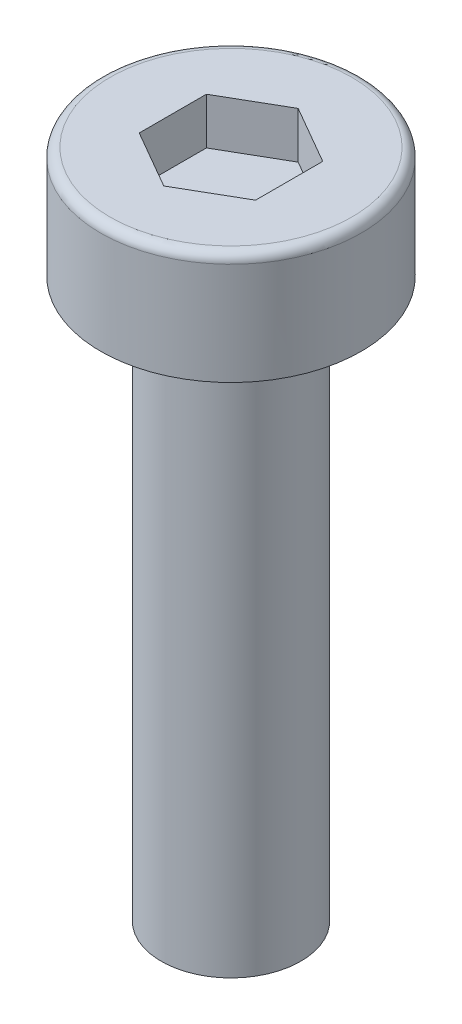
from build123d import *

# Parameters (mm, degrees)
CUT_EXTRUDE1_DEPTH = 1
FILLET1_R          = 0.2


with BuildPart() as part:
    # Sketch1 → Revolve1 (revolve)
    with BuildSketch(Plane.XY, mode=Mode.PRIVATE) as revolve1_sk:
        Polygon((0, 0), (0, 14.4), (2.8, 14.4), (2.8, 12), (1.5, 12), (1.5, 0), align=None)
    revolve(revolve1_sk.sketch.rotate(Axis((0, 0, 0), (0, 1, 0)), 90), axis=Axis((0, 0, 0), (0, 1, 0)))

    # Sketch2 → Cut-Extrude1 (cut)
    with BuildSketch(Plane(origin=(0, 14.4, 0), x_dir=(1, 0, 0), z_dir=(0, 1, 0))):
        Polygon((0, -1.443375673), (1.25, -0.721687836), (1.25, 0.721687836), (0, 1.443375673), (-1.25, 0.721687836), (-1.25, -0.721687836), align=None)
    extrude(amount=-CUT_EXTRUDE1_DEPTH, mode=Mode.SUBTRACT)

    # Fillet1
    fillet1_edges = [part.edges().sort_by_distance(p)[0] for p in [
        (0, 14.4, 2.8),
    ]]
    fillet(fillet1_edges, radius=FILLET1_R)


solid = part.part
